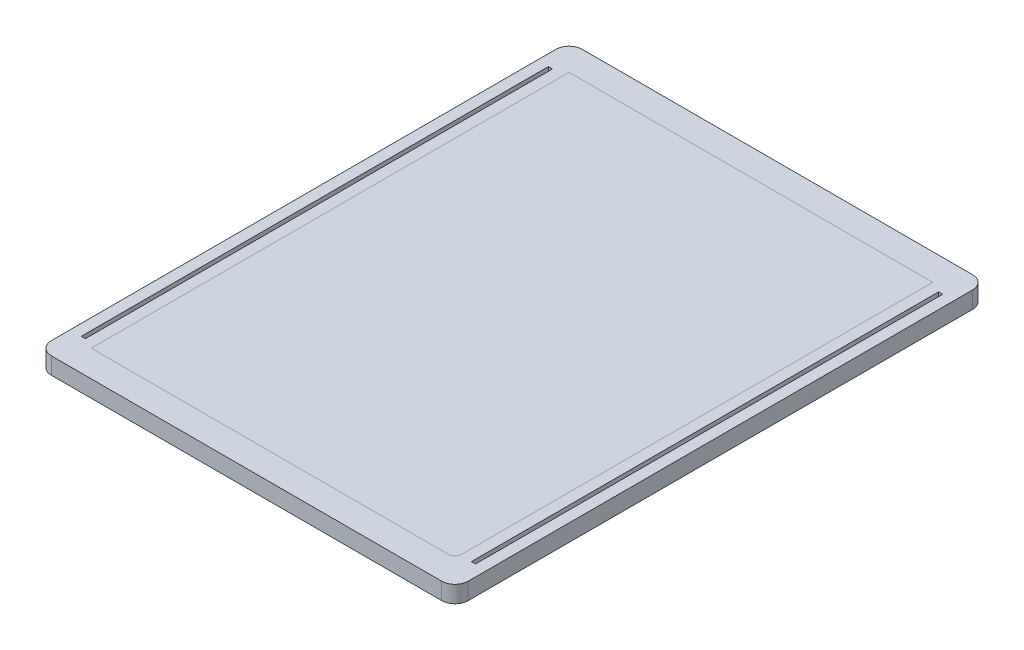
from build123d import *

# Parameters (mm, degrees)
SKETCH1_W           = 157
SKETCH1_H           = 200
SKETCH1_W_2         = 137
SKETCH1_H_2         = 180
MAINBODY_DEPTH      = 3.175
SHEETLOCK_REACH     = 129.289
SKETCH2_W           = 1.55575
SKETCH2_H           = 176
SKETCH4_W           = 180
SKETCH4_H           = 6.35
BOSS_EXTRUDE1_DEPTH = 137
FILLET1_R           = 5
FILLET2_R           = 2.5


with BuildPart() as part:
    # Sketch1 → MainBody (new, symmetric)
    with BuildSketch(Plane(origin=(0, 0, 0), x_dir=(1, 0, 0), z_dir=(0, 1, 0))):
        Rectangle(SKETCH1_W, SKETCH1_H)
        Rectangle(SKETCH1_W_2, SKETCH1_H_2, mode=Mode.SUBTRACT)
    extrude(amount=MAINBODY_DEPTH, both=True)

    # Sketch2 → SheetLock (cut, up to next)
    with BuildSketch(Plane(origin=(0, 3.175, 0), x_dir=(1, 0, 0), z_dir=(0, 1, 0)), mode=Mode.PRIVATE) as sheetlock_sk1:
        with Locations((-73.5, 0)):
            Rectangle(SKETCH2_W, SKETCH2_H)
    sheetlock_tool1 = extrude(sheetlock_sk1.sketch, amount=-SHEETLOCK_REACH, mode=Mode.PRIVATE) & part.part
    sheetlock = sheetlock_tool1.solids().sort_by_distance((-73.5, 3.175, 0))[0]
    add(sheetlock, mode=Mode.SUBTRACT)

    # Mirror1: SheetLock across plane
    add(sheetlock.mirror(Plane(origin=(0, 0, 0), x_dir=(0, 0, 1), z_dir=(1, 0, 0))), mode=Mode.SUBTRACT)

    # Fillet1
    fillet1_edges = [part.edges().sort_by_distance(p)[0] for p in [
        (78.5, 0, 100),
        (-78.5, 0, 100),
        (-78.5, 0, -100),
        (78.5, 0, -100),
    ]]
    fillet(fillet1_edges, radius=FILLET1_R)

    # Fillet2
    fillet2_edges = [part.edges().sort_by_distance(p)[0] for p in [
        (-68.5, 0, -90),
        (-68.5, 0, 90),
        (68.5, 0, 90),
        (68.5, 0, -90),
    ]]
    fillet(fillet2_edges, radius=FILLET2_R)


with BuildPart() as body_2:
    # Sketch4 → Boss-Extrude1 (new body)
    with BuildSketch(Plane.ZY.offset(-68.5)):
        Rectangle(SKETCH4_W, SKETCH4_H)
    extrude(amount=BOSS_EXTRUDE1_DEPTH)


solid = Compound([part.part, body_2.part])
